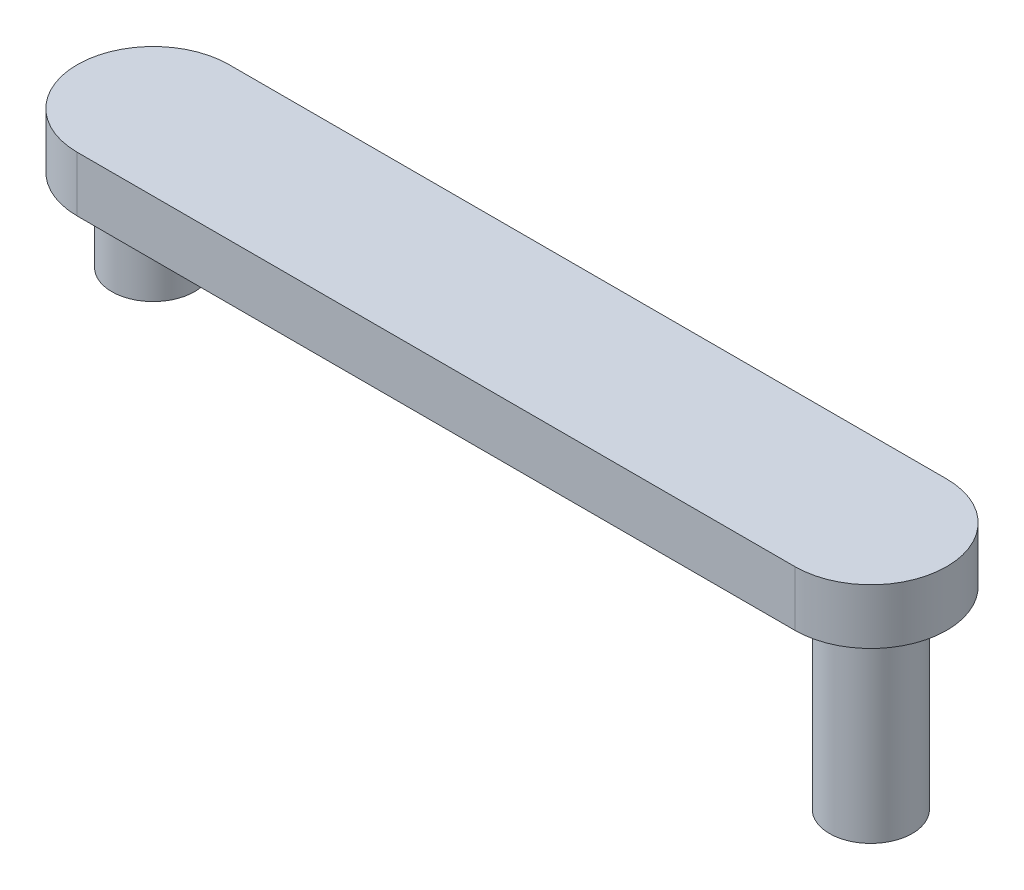
from build123d import *

# Parameters (mm, degrees)
SKETCH1_R           = 1.5
BOSS_EXTRUDE1_DEPTH = 3
BOSS_EXTRUDE2_DEPTH = 2
SKETCH3_R           = 1.5
BOSS_EXTRUDE3_DEPTH = 7


with BuildPart() as part:
    # Sketch1 → Boss-Extrude1 (new body)
    with BuildSketch(Plane(origin=(0, 0, 0), x_dir=(1, 0, 0), z_dir=(0, 1, 0))):
        with Locations(Location((0, 0, 0), (0, 0, 270))):
            Circle(SKETCH1_R)
    extrude(amount=BOSS_EXTRUDE1_DEPTH)

    # Sketch2 → Boss-Extrude2 (add)
    with BuildSketch(Plane(origin=(0, 3, 0), x_dir=(1, 0, 0), z_dir=(0, 1, 0))):
        with BuildLine():
            Line((0, 2.75), (26, 2.75))
            ThreePointArc((26, 2.75), (28.75, 0), (26, -2.75))
            Line((26, -2.75), (0, -2.75))
            ThreePointArc((0, -2.75), (-2.75, 0), (0, 2.75))
        make_face()
    extrude(amount=BOSS_EXTRUDE2_DEPTH)

    # Sketch3 → Boss-Extrude3 (add)
    with BuildSketch(Plane.XZ.offset(-3)):
        with Locations(Location((26, 0, 0), (0, 0, 90))):
            Circle(SKETCH3_R)
    extrude(amount=BOSS_EXTRUDE3_DEPTH)


solid = part.part
